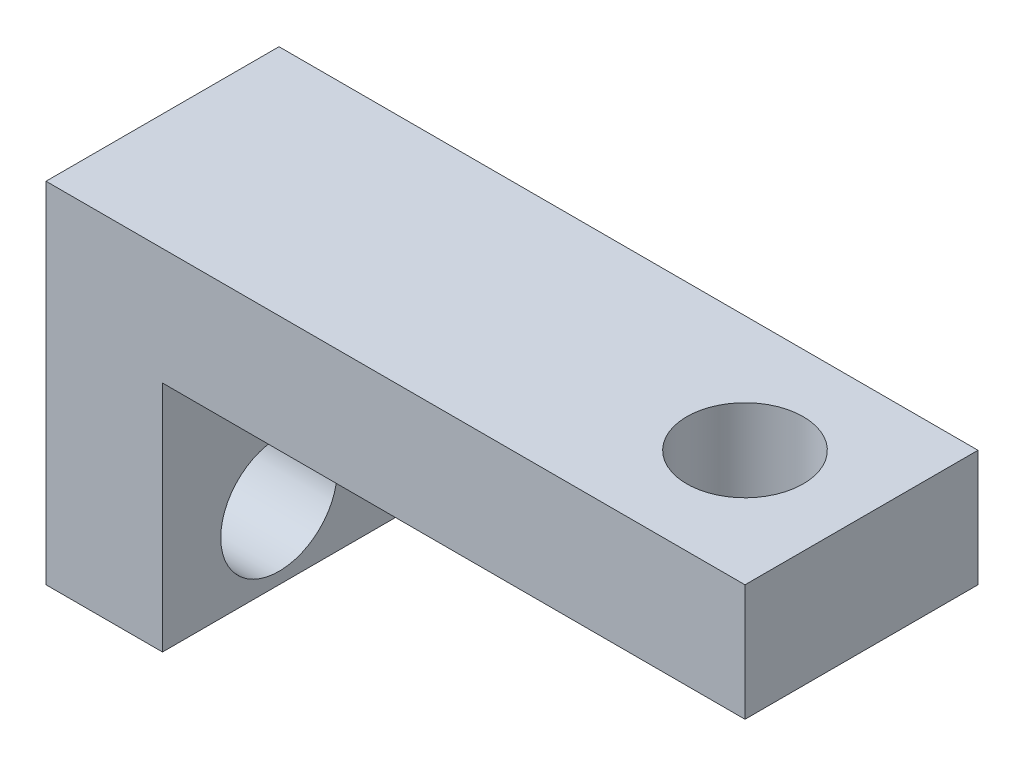
from build123d import *

# Parameters (mm, degrees)
BOSS_EXTRU_1_DEPTH      = 10
BOSS_EXTRU_1_DEPTH_BACK = 10
ESQUISSE2_R             = 5
ENL_V_MAT_EXTRU_1_DEPTH = 10
ESQUISSE3_R             = 5
ENL_V_MAT_EXTRU_2_DEPTH = 10


with BuildPart() as part:
    # Esquisse1 → Boss.-Extru.1 (new, two sides: drawn at the far end of the back side and taken through both)
    with BuildSketch(Plane.XY.offset(-BOSS_EXTRU_1_DEPTH_BACK)):
        Polygon((0, 0), (10, 0), (10, 20), (60, 20), (60, 30), (0, 30), align=None)
    extrude(amount=BOSS_EXTRU_1_DEPTH + BOSS_EXTRU_1_DEPTH_BACK)

    # Esquisse2 → Enlèv. mat.-Extru.1 (cut)
    with BuildSketch(Plane.XZ.offset(-20)):
        with Locations((50, 0)):
            Circle(ESQUISSE2_R)
    extrude(amount=-ENL_V_MAT_EXTRU_1_DEPTH, mode=Mode.SUBTRACT)

    # Esquisse3 → Enlèv. mat.-Extru.2 (cut)
    with BuildSketch(Plane.ZY):
        with Locations((0, 6)):
            Circle(ESQUISSE3_R)
    extrude(amount=-ENL_V_MAT_EXTRU_2_DEPTH, mode=Mode.SUBTRACT)


solid = part.part
